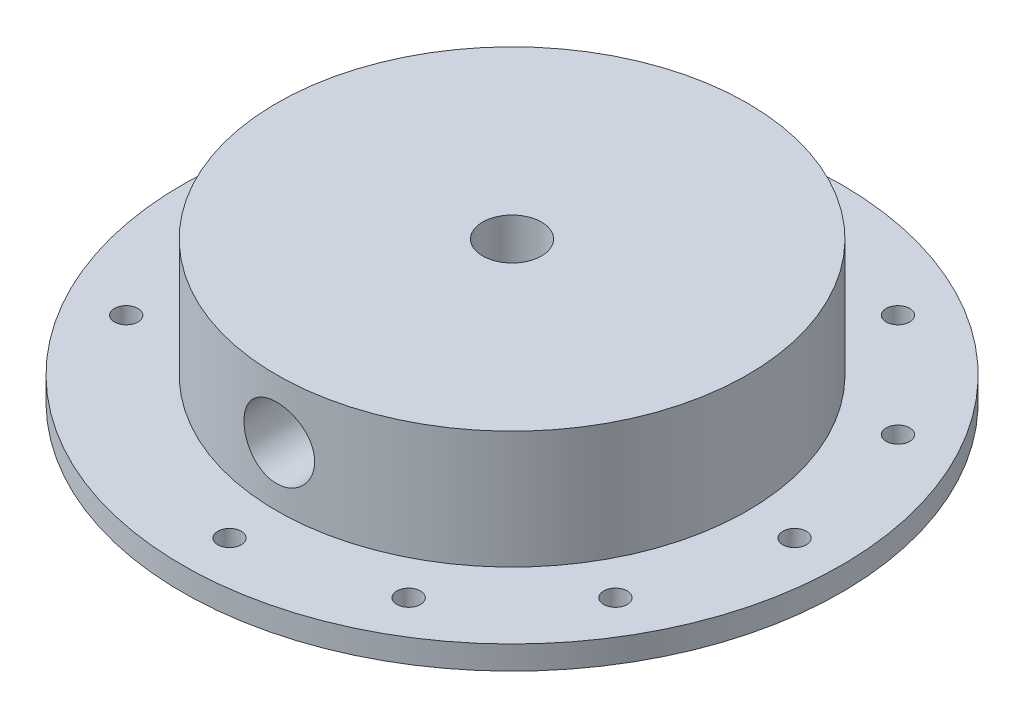
from build123d import *

# Parameters (mm, degrees)
F_1_4_0_25_DIAMETER_HOLE1_D = 6.35
CIRPATTERN2_COUNT           = 12
SKETCH6_R                   = 9.525
CUT_EXTRUDE1_DEPTH          = 132.369821496


with BuildPart() as part:
    # Sketch1 → Revolve1 (revolve)
    with BuildSketch(Plane.XY, mode=Mode.PRIVATE) as revolve1_sk:
        with BuildLine():
            Line((7.9375, 38.1), (7.9375, 11.1125))
            ThreePointArc((7.9375, 11.1125), (22.02778747, 2.86649456), (38.1, 0))
            Line((38.1, 0), (88.9, 0))
            Line((88.9, 0), (88.9, 6.35))
            Line((88.9, 6.35), (63.5, 6.35))
            Line((63.5, 6.35), (63.5, 38.1))
            Line((63.5, 38.1), (7.9375, 38.1))
        make_face()
    revolve(revolve1_sk.sketch.rotate(Axis((0, 0, 0), (0, 1, 0)), 90), axis=Axis((0, 0, 0), (0, 1, 0)))

    # 1/4 (0.25) Diameter Hole1 (through all)
    with Locations(Plane(origin=(0, 6.35, 0), x_dir=(1, 0, 0), z_dir=(0, 1, 0))):
        with Locations((0, -76.2)):
            f_1_4_0_25_diameter_hole1 = Hole(F_1_4_0_25_DIAMETER_HOLE1_D / 2)

    # CirPattern2: 1/4 (0.25) Diameter Hole1 ×12 about axis, 1 skipped
    cirpattern2_axis = Axis((0, 0, 0), (0, 1, 0))
    add([f_1_4_0_25_diameter_hole1.rotate(cirpattern2_axis, i * 360 / CIRPATTERN2_COUNT) for i in range(1, CIRPATTERN2_COUNT) if i not in (11,)], mode=Mode.SUBTRACT)

    # Sketch6 → Cut-Extrude1 (cut, through all)
    with BuildSketch(Plane.XY):
        with Locations(Location((0, 22.225, 0), (0, 0, 180))):
            Circle(SKETCH6_R)
    extrude(amount=CUT_EXTRUDE1_DEPTH, mode=Mode.SUBTRACT)


solid = part.part
